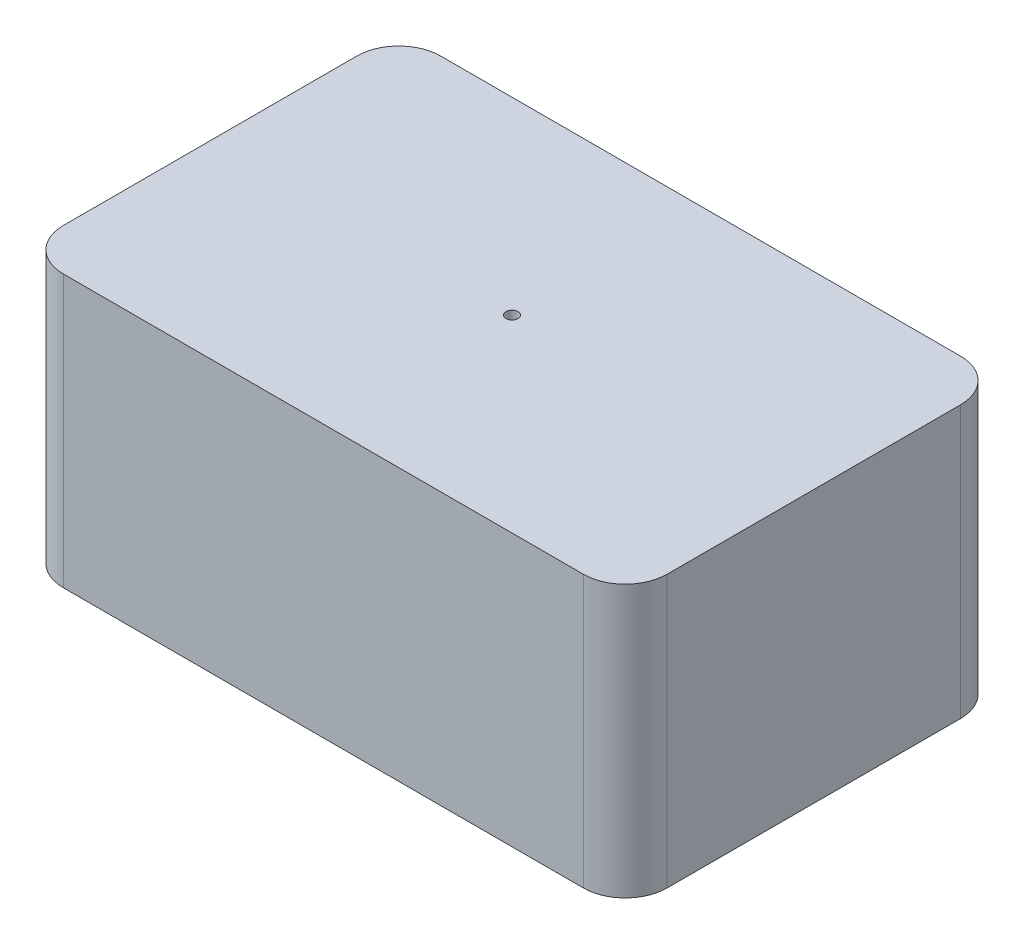
from build123d import *

# Parameters (mm, degrees)
SKETCH2_R           = 0.4
BOSS_EXTRUDE1_DEPTH = 18
CUT_EXTRUDE1_DEPTH  = 17


with BuildPart() as part:
    # Sketch2 → Boss-Extrude1 (new body)
    with BuildSketch(Plane(origin=(0, 0, 0), x_dir=(1, 0, 0), z_dir=(0, 1, 0))):
        with BuildLine():
            Line((-20, 9.723165676), (-20, -9.723165676))
            ThreePointArc((-20, -9.723165676), (-19.186684057, -11.686684057), (-17.223165676, -12.5))
            Line((-17.223165676, -12.5), (17.223165676, -12.5))
            ThreePointArc((17.223165676, -12.5), (19.186684057, -11.686684057), (20, -9.723165676))
            Line((20, -9.723165676), (20, 9.723165676))
            ThreePointArc((20, 9.723165676), (19.186684057, 11.686684057), (17.223165676, 12.5))
            Line((17.223165676, 12.5), (-17.223165676, 12.5))
            ThreePointArc((-17.223165676, 12.5), (-19.186684057, 11.686684057), (-20, 9.723165676))
        make_face()
        with Locations(Location((0, 0, 0), (0, 0, 270))):
            Circle(SKETCH2_R, mode=Mode.SUBTRACT)
    extrude(amount=BOSS_EXTRUDE1_DEPTH)

    # Sketch3 → Cut-Extrude1 (cut)
    with BuildSketch(Plane.XZ):
        with BuildLine():
            Line((19, -9.723165676), (19, 9.723165676))
            ThreePointArc((19, 9.723165676), (18.479577276, 10.979577276), (17.223165676, 11.5))
            Line((17.223165676, 11.5), (-17.223165676, 11.5))
            ThreePointArc((-17.223165676, 11.5), (-18.479577276, 10.979577276), (-19, 9.723165676))
            Line((-19, 9.723165676), (-19, -9.723165676))
            ThreePointArc((-19, -9.723165676), (-18.479577276, -10.979577276), (-17.223165676, -11.5))
            Line((-17.223165676, -11.5), (17.223165676, -11.5))
            ThreePointArc((17.223165676, -11.5), (18.479577276, -10.979577276), (19, -9.723165676))
        make_face()
    extrude(amount=-CUT_EXTRUDE1_DEPTH, mode=Mode.SUBTRACT)


solid = part.part
